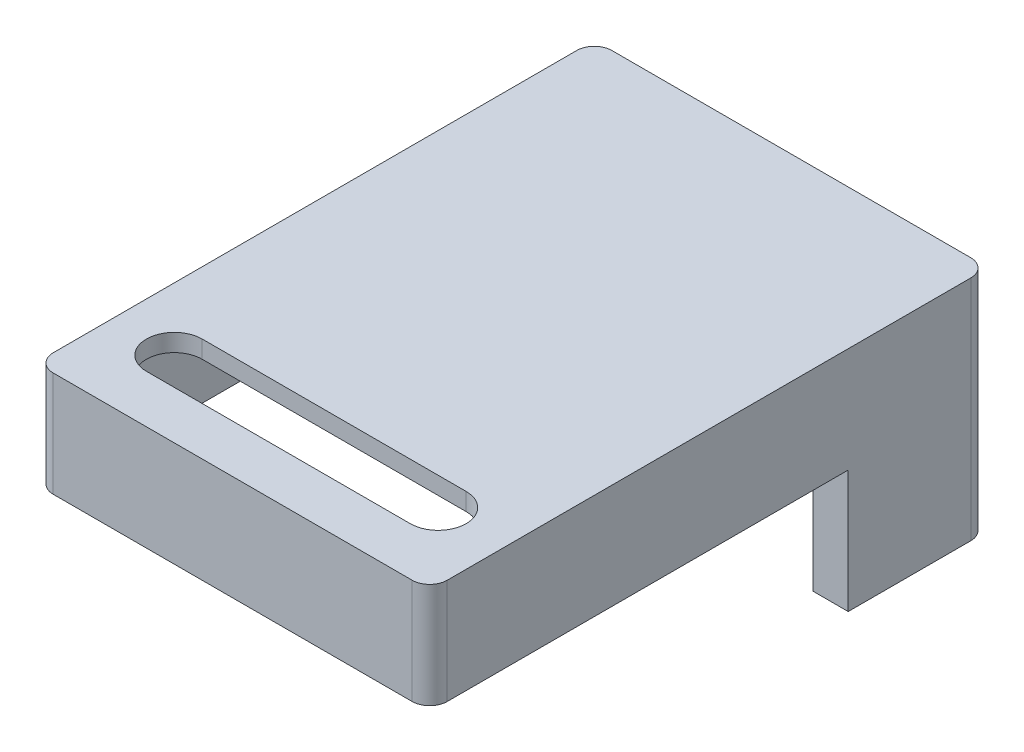
from build123d import *

# Parameters (mm, degrees)
BOSS_EXTRUDE33_DEPTH = 5
BOSS_EXTRUDE34_START = 5
BOSS_EXTRUDE34_DEPTH = 1
BOSS_EXTRUDE35_START = -7
BOSS_EXTRUDE35_DEPTH = 7
CUT_EXTRUDE2_DEPTH   = 2


with BuildPart() as part:
    # lid → Boss-Extrude33 (new body)
    with BuildSketch(Plane(origin=(0, 0, 0), x_dir=(1, 0, 0), z_dir=(0, 1, 0))):
        with BuildLine():
            Line((-11.25, 22), (-11.25, -7.9))
            ThreePointArc((-11.25, -7.9), (-10.957106781, -8.607106781), (-10.25, -8.9))
            Line((-10.25, -8.9), (10.25, -8.9))
            ThreePointArc((10.25, -8.9), (10.957106781, -8.607106781), (11.25, -7.9))
            Line((11.25, -7.9), (11.25, 22))
            ThreePointArc((11.25, 22), (10.957106781, 22.707106781), (10.25, 23))
            Line((10.25, 23), (-10.25, 23))
            ThreePointArc((-10.25, 23), (-10.957106781, 22.707106781), (-11.25, 22))
        make_face()
        with BuildLine():
            Line((9.25, 21.75), (9.25, 15))
            Line((9.25, 15), (10.5, 15))
            Line((10.5, 15), (10.5, -7.65))
            ThreePointArc((10.5, -7.65), (10.353553391, -8.003553391), (10, -8.15))
            Line((10, -8.15), (-10, -8.15))
            ThreePointArc((-10, -8.15), (-10.353553391, -8.003553391), (-10.5, -7.65))
            Line((-10.5, -7.65), (-10.5, 15))
            Line((-10.5, 15), (-9.25, 15))
            Line((-9.25, 15), (-9.25, 21.75))
            ThreePointArc((-9.25, 21.75), (-9.103553391, 22.103553391), (-8.75, 22.25))
            Line((-8.75, 22.25), (8.75, 22.25))
            ThreePointArc((8.75, 22.25), (9.103553391, 22.103553391), (9.25, 21.75))
        make_face(mode=Mode.SUBTRACT)
    extrude(amount=BOSS_EXTRUDE33_DEPTH)

    # lid<5> → Boss-Extrude34 (add)
    with BuildSketch(Plane(origin=(0, 0, 0), x_dir=(1, 0, 0), z_dir=(0, 1, 0)).offset(BOSS_EXTRUDE34_START)):
        with BuildLine():
            Line((-11.25, 22), (-11.25, -7.9))
            ThreePointArc((-11.25, -7.9), (-10.957106781, -8.607106781), (-10.25, -8.9))
            Line((-10.25, -8.9), (10.25, -8.9))
            ThreePointArc((10.25, -8.9), (10.957106781, -8.607106781), (11.25, -7.9))
            Line((11.25, -7.9), (11.25, 22))
            ThreePointArc((11.25, 22), (10.957106781, 22.707106781), (10.25, 23))
            Line((10.25, 23), (-10.25, 23))
            ThreePointArc((-10.25, 23), (-10.957106781, 22.707106781), (-11.25, 22))
        make_face()
    extrude(amount=BOSS_EXTRUDE34_DEPTH)

    # lid<6> → Boss-Extrude35 (add)
    with BuildSketch(Plane(origin=(0, 0, 0), x_dir=(1, 0, 0), z_dir=(0, 1, 0)).offset(BOSS_EXTRUDE35_START)):
        with BuildLine():
            Line((9.25, 21.75), (9.25, 15))
            Line((9.25, 15), (10.5, 15))
            Line((10.5, 15), (11.25, 15))
            Line((11.25, 15), (11.25, 22))
            ThreePointArc((11.25, 22), (10.957106781, 22.707106781), (10.25, 23))
            Line((10.25, 23), (-10.25, 23))
            ThreePointArc((-10.25, 23), (-10.957106781, 22.707106781), (-11.25, 22))
            Line((-11.25, 22), (-11.25, 15))
            Line((-11.25, 15), (-10.5, 15))
            Line((-10.5, 15), (-9.25, 15))
            Line((-9.25, 15), (-9.25, 21.75))
            ThreePointArc((-9.25, 21.75), (-9.103553391, 22.103553391), (-8.75, 22.25))
            Line((-8.75, 22.25), (8.75, 22.25))
            ThreePointArc((8.75, 22.25), (9.103553391, 22.103553391), (9.25, 21.75))
        make_face()
    extrude(amount=BOSS_EXTRUDE35_DEPTH)

    # Sketch20 → Cut-Extrude2 (cut)
    with BuildSketch(Plane(origin=(0, 6, 0), x_dir=(1, 0, 0), z_dir=(0, 1, 0))):
        with BuildLine():
            Line((-7.672345443, -2.966739157), (7.39782559, -2.966739157))
            ThreePointArc((7.39782559, -2.966739157), (8.993011438, -4.561925004), (7.39782559, -6.157110852))
            Line((7.39782559, -6.157110852), (-7.672345443, -6.157110852))
            ThreePointArc((-7.672345443, -6.157110852), (-9.26753129, -4.561925004), (-7.672345443, -2.966739157))
        make_face()
    extrude(amount=-CUT_EXTRUDE2_DEPTH, mode=Mode.SUBTRACT)


solid = part.part
